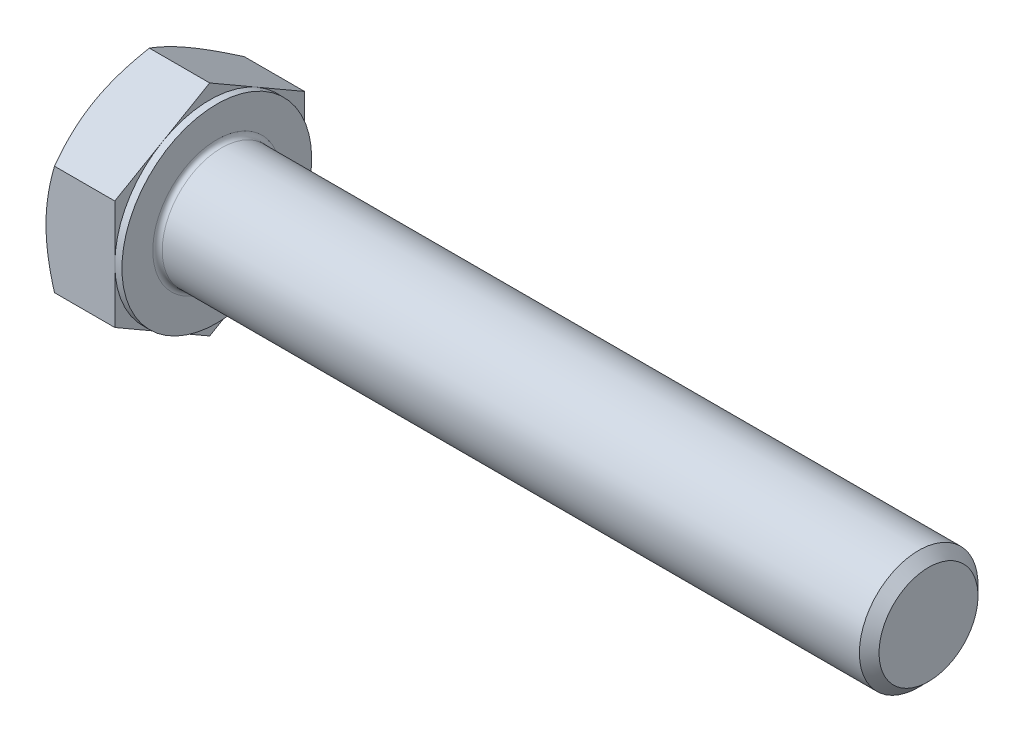
from build123d import *

# Parameters (mm, degrees)
BASEHEAD_DEPTH = 6.4
HEADFILLET_R   = 0.4
SKETCH4_W      = 0.6
SKETCH4_H      = 11.237604307


with BuildPart() as part:
    # Sketch1 → BaseHead (new body)
    with BuildSketch(Plane(origin=(0, 0, 0), x_dir=(0, 0, -1), z_dir=(1, 0, 0))):
        Polygon((8, 4.618802154), (8, -4.618802154), (0, -9.237604307), (-8, -4.618802154), (-8, 4.618802154), (0, 9.237604307), align=None)
    extrude(amount=BASEHEAD_DEPTH)

    # Sketch3 → HeadChamfer (revolve, cut)
    with BuildSketch(Plane.XY, mode=Mode.PRIVATE) as headchamfer_sk:
        Polygon((0, 8), (3.601282526, 14.237604307), (3.601282526, 19.237604307), (-10, 19.237604307), (-10, 8), align=None)
    revolve(headchamfer_sk.sketch.rotate(Axis((0, 0, 0), (1, 0, 0)), 90), axis=Axis((0, 0, 0), (1, 0, 0)), mode=Mode.SUBTRACT)

    # BodySke → BaseBody (revolve)
    with BuildSketch(Plane.XY, mode=Mode.PRIVATE) as basebody_sk:
        Polygon((0, 0), (66.4, 0), (66.4, 4.172), (65.572, 5), (0, 5), align=None)
    revolve(basebody_sk.sketch.rotate(Axis((0, 0, 0), (1, 0, 0)), 90), axis=Axis((0, 0, 0), (1, 0, 0)))

    # HeadFillet
    headfillet_edges = [part.edges().sort_by_distance(p)[0] for p in [
        (6.4, 0, -5),
    ]]
    fillet(headfillet_edges, radius=HEADFILLET_R)

    # Sketch4 → BearingFace (revolve, cut)
    with BuildSketch(Plane.XY, mode=Mode.PRIVATE) as bearingface_sk:
        with Locations((6.1, 13.618802154)):
            Rectangle(SKETCH4_W, SKETCH4_H)
    revolve(bearingface_sk.sketch.rotate(Axis((0, 0, 0), (1, 0, 0)), 270), axis=Axis((0, 0, 0), (1, 0, 0)), mode=Mode.SUBTRACT)


solid = part.part
